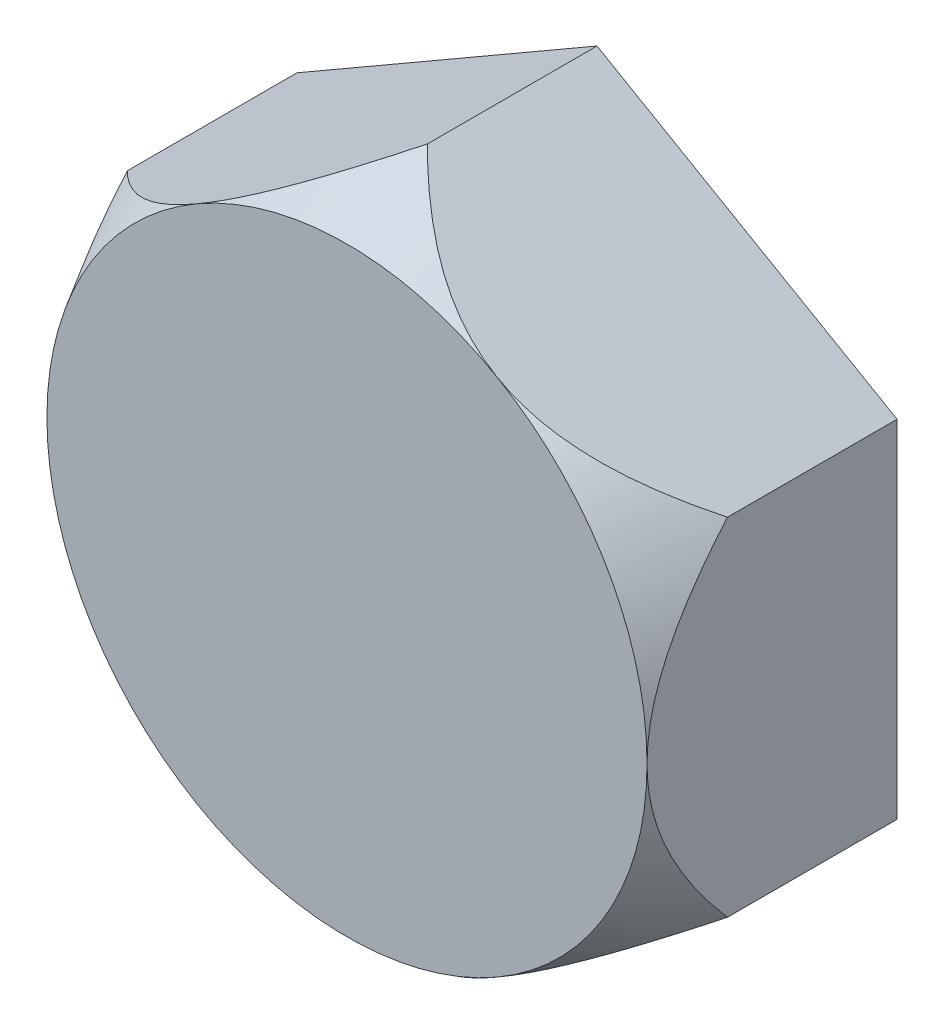
from build123d import *

# Parameters (mm, degrees)
BOSS_EXTRUDE1_DEPTH = 25
SKETCH2_OUTSIDE_W   = 142.428
SKETCH2_OUTSIDE_H   = 151.71
SKETCH2_OUTSIDE_R   = 29.999119987
CUT_EXTRUDE2_DEPTH  = 53.200352489
CUT_EXTRUDE2_DRAFT  = -30


with BuildPart() as part:
    # Sketch1 → Boss-Extrude1 (new body)
    with BuildSketch(Plane.XY):
        Polygon((0, -34.64), (29.999119987, -17.32), (29.999119987, 17.32), (0, 34.64), (-29.999119987, 17.32), (-29.999119987, -17.32), align=None)
    extrude(amount=BOSS_EXTRUDE1_DEPTH)


with BuildPart() as cut_extrude2_tool:
    # Sketch2 outside → Cut-Extrude2 (with draft: the straight prism first)
    with BuildSketch(Plane.XY.offset(25)):
        Rectangle(SKETCH2_OUTSIDE_W, SKETCH2_OUTSIDE_H)
        Circle(SKETCH2_OUTSIDE_R, mode=Mode.SUBTRACT)
    extrude(amount=-CUT_EXTRUDE2_DEPTH)
    # Cut-Extrude2: the draft: its side faces are tilted about the plane it starts from
    cut_extrude2_sides = [cut_extrude2_tool.faces().sort_by_distance(p)[0] for p in [
        (0, -75.855, -1.600176245),
        (71.214, 0, -1.600176245),
        (0, 75.855, -1.600176245),
        (-71.214, 0, -1.600176245),
        (-29.999119987, 0, -1.600176245),
    ]]
    draft(cut_extrude2_sides, Plane.XY.offset(25), CUT_EXTRUDE2_DRAFT)


with BuildPart() as part_1:
    add(part.part)

    # Cut-Extrude2: cut by cut_extrude2_tool
    add(cut_extrude2_tool.part, mode=Mode.SUBTRACT)


solid = part_1.part
